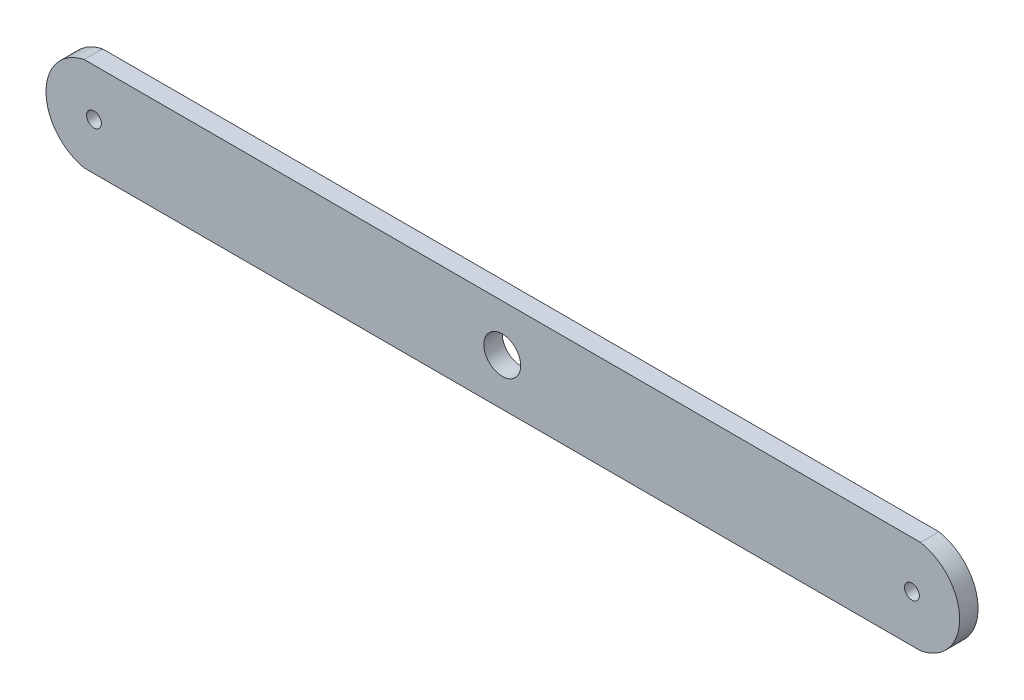
from build123d import *

# Parameters (mm, degrees)
SKETCH1_R           = 4
SKETCH1_R_2         = 10
BOSS_EXTRUDE1_DEPTH = 10


with BuildPart() as part:
    # Sketch1 → Boss-Extrude1 (new body)
    with BuildSketch(Plane.XY):
        with BuildLine():
            Line((-233.912946187, 26.004294273), (220.138323958, 26.004294273))
            ThreePointArc((220.138323958, 26.004294273), (241.397579977, 0.523539484), (220.138323958, -24.957215306))
            Line((220.138323958, -24.957215306), (-233.912946187, -24.957215306))
            ThreePointArc((-233.912946187, -24.957215306), (-254.551185112, 0.523539484), (-233.912946187, 26.004294273))
        make_face()
        with Locations((-228.502311114, 0.523539484)):
            Circle(SKETCH1_R, mode=Mode.SUBTRACT)
        with Locations((-6.887311114, 0.523539484)):
            Circle(SKETCH1_R_2, mode=Mode.SUBTRACT)
        with Locations((215.497688886, 0.523539484)):
            Circle(SKETCH1_R, mode=Mode.SUBTRACT)
    extrude(amount=BOSS_EXTRUDE1_DEPTH)


solid = part.part
